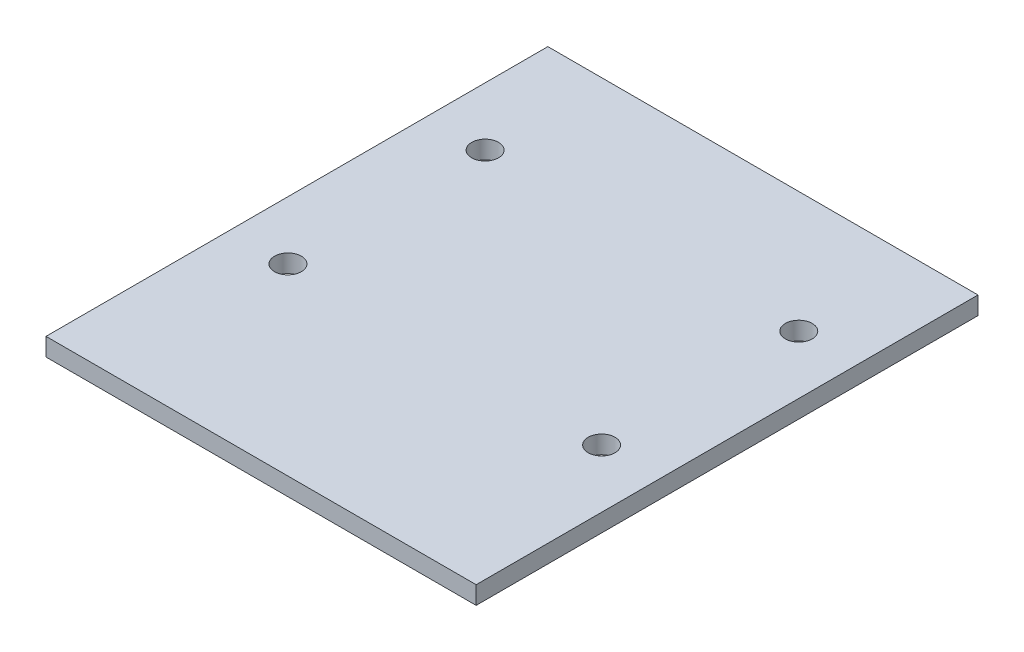
from build123d import *

# Parameters (mm, degrees)
SKETCH1_W                    = 152.4
SKETCH1_H                    = 177.8
BOSS_EXTRUDE1_DEPTH          = 3.175
F_3_8_0_375_DIAMETER_HOLE1_D = 9.525


with BuildPart() as part:
    # Sketch1 → Boss-Extrude1 (new, symmetric)
    with BuildSketch(Plane(origin=(0, 0, 0), x_dir=(1, 0, 0), z_dir=(0, 1, 0))):
        Rectangle(SKETCH1_W, SKETCH1_H)
    extrude(amount=BOSS_EXTRUDE1_DEPTH, both=True)

    # 3/8 (0.375) Diameter Hole1 (through all)
    with Locations(Plane(origin=(0, 3.175, 0), x_dir=(1, 0, 0), z_dir=(0, 1, 0))):
        with Locations((-55.5625, 46.0375), (-55.5625, -23.8125), (55.5625, -23.8125), (55.5625, 46.0375)):
            Hole(F_3_8_0_375_DIAMETER_HOLE1_D / 2)


solid = part.part
